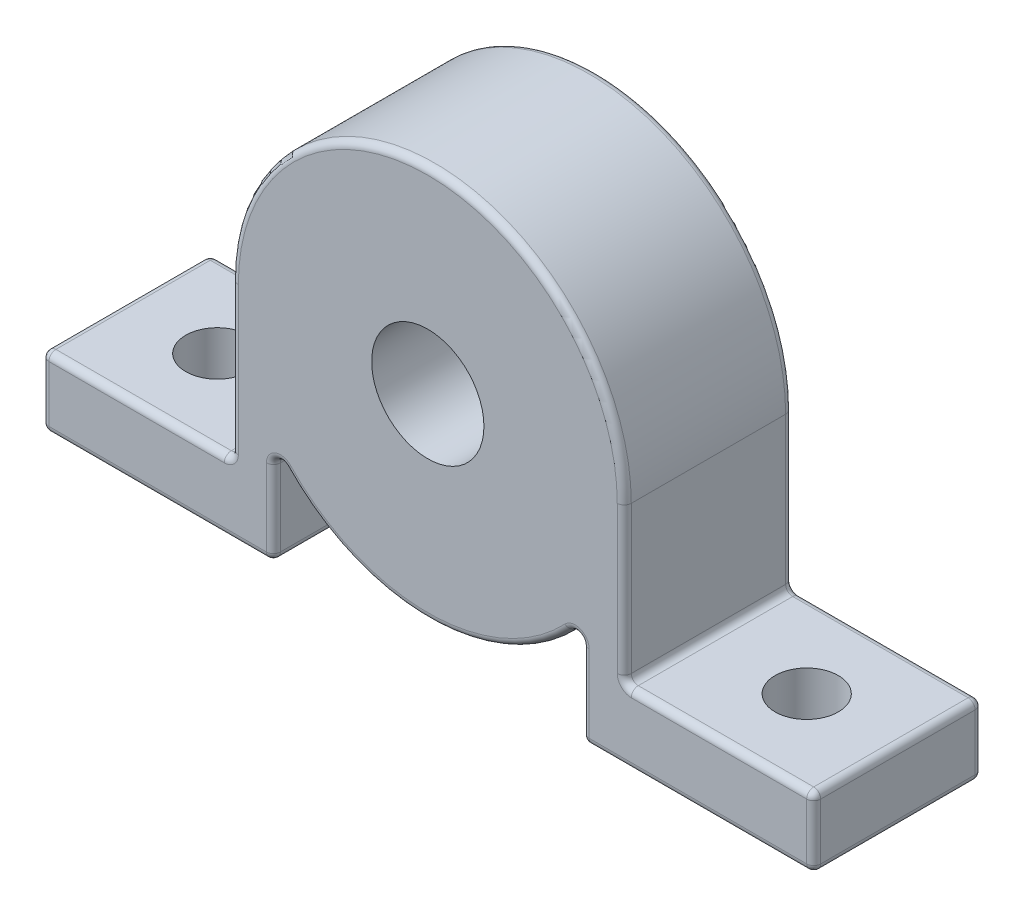
from build123d import *

# Parameters (mm, degrees)
SKETCH_1_R          = 4
EXTRUDE_6_DEPTH     = 6
FILLET_2_R          = 0.5
CUT_EXTRUDE_1_REACH = 39.646
SKETCH_5_R          = 2.25
CUT_EXTRUDE_2_REACH = 39.646
SKETCH_8_R          = 2.25


with BuildPart() as part:
    # 草图1 → 凸台-拉伸6 (new, symmetric)
    with BuildSketch(Plane.XY):
        with BuildLine():
            Line((-27.5, 5), (-27.5, 0))
            Line((-27.5, 0), (-11, 0))
            Line((-11, 0), (-11, 7.339745962))
            ThreePointArc((-11, 7.339745962), (0, 2), (11, 7.339745962))
            Line((11, 7.339745962), (11, 0))
            Line((11, 0), (27.5, 0))
            Line((27.5, 0), (27.5, 5))
            Line((27.5, 5), (14, 5))
            Line((14, 5), (14, 16))
            ThreePointArc((14, 16), (0, 30), (-14, 16))
            Line((-14, 16), (-14, 5))
            Line((-14, 5), (-27.5, 5))
        make_face()
        with Locations((0, 16)):
            Circle(SKETCH_1_R, mode=Mode.SUBTRACT)
    extrude(amount=EXTRUDE_6_DEPTH, both=True)

    # 圆角2
    fillet_2_edges = [part.edges().sort_by_distance(p)[0] for p in [
        (11, 3.669872981, 6),
        (-19.25, 0, -6),
        (-27.5, 2.5, -6),
        (-20.75, 5, -6),
        (-14, 10.5, -6),
        (0, 30, -6),
        (14, 10.5, -6),
        (20.75, 5, -6),
        (19.25, 0, 6),
        (27.5, 2.5, -6),
        (19.25, 0, -6),
        (11, 3.669872981, -6),
        (0, 2, -6),
        (-11, 3.669872981, -6),
        (27.5, 2.5, 6),
        (-11, 0, 0),
        (-27.5, 0, 0),
        (-27.5, 5, 0),
        (-14, 5, 0),
        (14, 5, 0),
        (27.5, 5, 0),
        (27.5, 0, 0),
        (11, 0, 0),
        (11, 7.339745962, 0),
        (-11, 7.339745962, 0),
        (20.75, 5, 6),
        (14, 10.5, 6),
        (0, 30, 6),
        (-14, 10.5, 6),
        (-20.75, 5, 6),
        (-27.5, 2.5, 6),
        (-19.25, 0, 6),
        (-11, 3.669872981, 6),
        (0, 2, 6),
    ]]
    fillet(fillet_2_edges, radius=FILLET_2_R)

    # 草图5 → 切除-拉伸1 (cut, up to next)
    with BuildSketch(Plane(origin=(0, 5, 0), x_dir=(1, 0, 0), z_dir=(0, 1, 0)), mode=Mode.PRIVATE) as cut_extrude_1_sk1:
        with Locations(Location((21, 0, 0), (0, 0, 270))):
            Circle(SKETCH_5_R)
    cut_extrude_1_tool1 = extrude(cut_extrude_1_sk1.sketch, amount=-CUT_EXTRUDE_1_REACH, mode=Mode.PRIVATE) & part.part
    add(cut_extrude_1_tool1.solids().sort_by_distance((21, 5, 0))[0], mode=Mode.SUBTRACT)

    # 草图8 → 切除-拉伸2 (cut, up to next)
    with BuildSketch(Plane(origin=(0, 5, 0), x_dir=(1, 0, 0), z_dir=(0, 1, 0)), mode=Mode.PRIVATE) as cut_extrude_2_sk1:
        with Locations(Location((-21, 0, 0), (0, 0, 270))):
            Circle(SKETCH_8_R)
    cut_extrude_2_tool1 = extrude(cut_extrude_2_sk1.sketch, amount=-CUT_EXTRUDE_2_REACH, mode=Mode.PRIVATE) & part.part
    add(cut_extrude_2_tool1.solids().sort_by_distance((-21, 5, 0))[0], mode=Mode.SUBTRACT)


solid = part.part
